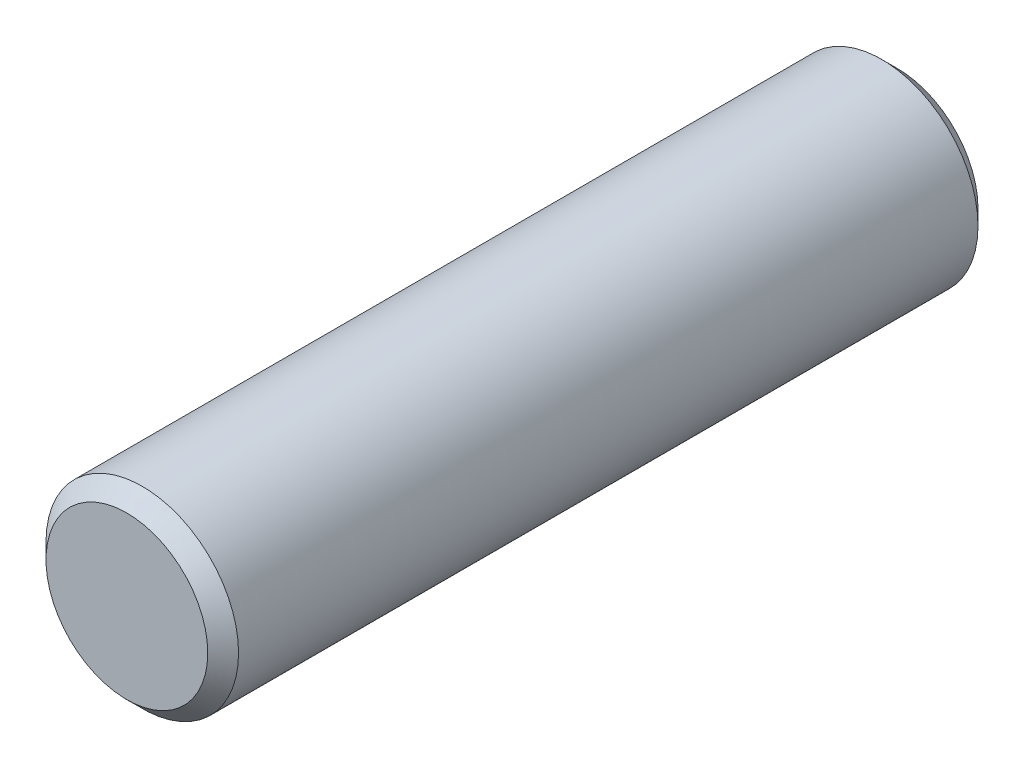
from build123d import *

# Parameters (mm, degrees)
SKETCH1_R           = 2.5
BOSS_EXTRUDE1_DEPTH = 20
CHAMFER1_SIZE       = 0.4


with BuildPart() as part:
    # Sketch1 → Boss-Extrude1 (new body)
    with BuildSketch(Plane.XY):
        Circle(SKETCH1_R)
    extrude(amount=BOSS_EXTRUDE1_DEPTH)

    # Chamfer1
    chamfer1_edges = [part.edges().sort_by_distance(p)[0] for p in [
        (-2.5, 0, 0),
        (-2.5, 0, 20),
    ]]
    chamfer(chamfer1_edges, length=CHAMFER1_SIZE)


solid = part.part
